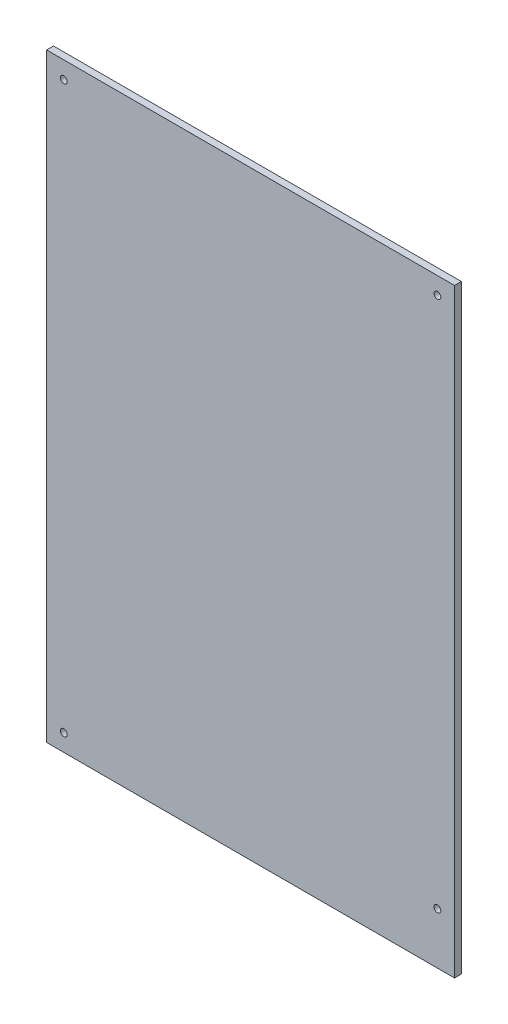
from build123d import *

# Parameters (mm, degrees)
SKICA1_W                = 238
SKICA1_H                = 350
SKICA1_R                = 2
P_IDAT_VYSUNUT_M1_DEPTH = 4


with BuildPart() as part:
    # Skica1 → Přidat vysunutím1 (new body)
    with BuildSketch(Plane.XY):
        Rectangle(SKICA1_W, SKICA1_H)
        with Locations((109, 165)):
            Circle(SKICA1_R, mode=Mode.SUBTRACT)
        with Locations((109, -145)):
            Circle(SKICA1_R, mode=Mode.SUBTRACT)
        with Locations((-109, 165)):
            Circle(SKICA1_R, mode=Mode.SUBTRACT)
        with Locations((-109, -165)):
            Circle(SKICA1_R, mode=Mode.SUBTRACT)
    extrude(amount=P_IDAT_VYSUNUT_M1_DEPTH)


solid = part.part
